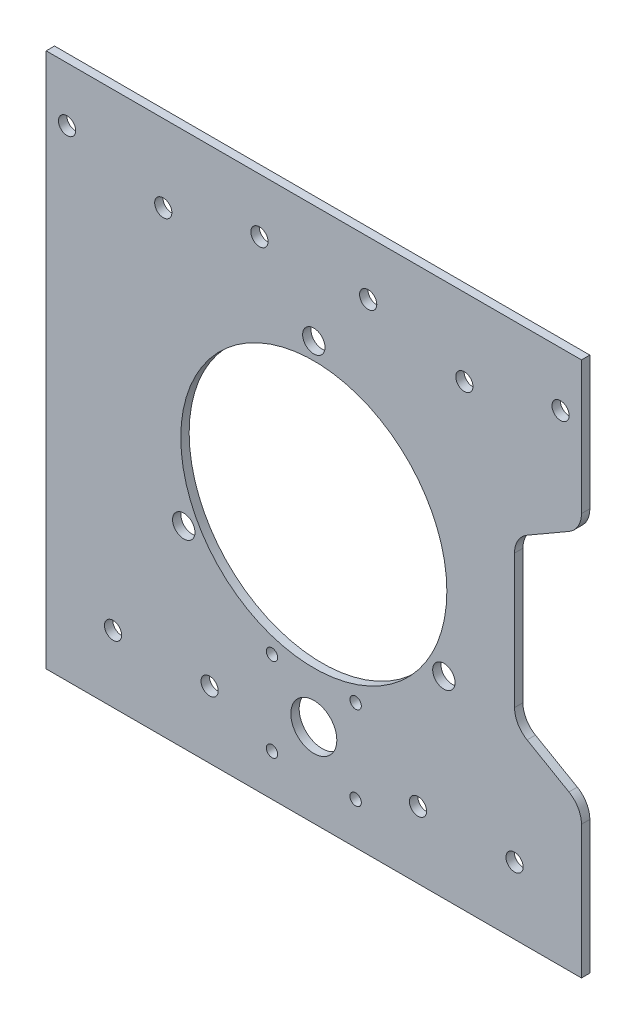
from build123d import *

# Parameters (mm, degrees)
SKETCH1_W               = 203.2
SKETCH1_H               = 203.2
BOSS_EXTRUDE1_DEPTH     = 3.175
SKETCH8_R               = 50.5
SKETCH8_R_2             = 4.25
CUT_EXTRUDE3_DEPTH      = 144.719172782
CUT_EXTRUDE4_DEPTH      = 144.719172782
F_1_4_CLEARANCE_HOLE2_D = 6.5278
F_1_4_CLEARANCE_HOLE1_D = 6.5278
F_8_CLEARANCE_HOLE2_D   = 4.3053
SKETCH19_R              = 8.73125
CUT_EXTRUDE5_DEPTH      = 144.719172782


with BuildPart() as part:
    # Sketch1 → Boss-Extrude1 (new body)
    with BuildSketch(Plane.XY):
        Rectangle(SKETCH1_W, SKETCH1_H)
    extrude(amount=-BOSS_EXTRUDE1_DEPTH)

    # Sketch8 → Cut-Extrude3 (cut, through all)
    with BuildSketch(Plane.XY):
        Circle(SKETCH8_R)
        with Locations((0, 57)):
            Circle(SKETCH8_R_2)
        with Locations((-49.363448016, -28.5)):
            Circle(SKETCH8_R_2)
        with Locations((49.363448016, -28.5)):
            Circle(SKETCH8_R_2)
    extrude(amount=-CUT_EXTRUDE3_DEPTH, mode=Mode.SUBTRACT)

    # Sketch10 → Cut-Extrude4 (cut, through all)
    with BuildSketch(Plane.XY):
        with BuildLine():
            Line((96.8375, 42.814327494), (80.9625, 33.648891971))
            ThreePointArc((80.9625, 33.648891971), (77.476108029, 30.1625), (76.2, 25.4))
            Line((76.2, 25.4), (76.2, -25.4))
            ThreePointArc((76.2, -25.4), (77.476108029, -30.1625), (80.9625, -33.648891971))
            Line((80.9625, -33.648891971), (96.8375, -42.814327494))
            ThreePointArc((96.8375, -42.814327494), (100.323891971, -46.300719465), (101.6, -51.063219465))
            Line((101.6, -51.063219465), (101.6, 51.063219465))
            ThreePointArc((101.6, 51.063219465), (100.323891971, 46.300719465), (96.8375, 42.814327494))
        make_face()
    extrude(amount=-CUT_EXTRUDE4_DEPTH, mode=Mode.SUBTRACT)

    # 1/4 Clearance Hole2 (through all)
    with Locations(Plane.XY):
        with Locations((76.2, -76.2), (39.553111932, -76.2), (-39.553111932, -76.2), (-76.2, -76.2)):
            Hole(F_1_4_CLEARANCE_HOLE2_D / 2)

    # 1/4 Clearance Hole1 (through all)
    with Locations(Plane.XY):
        with Locations((-93.6625, 80.9625), (-57.15, 72.23125), (-20.6375, 80.9625), (20.6375, 80.9625), (57.15, 72.23125), (93.6625, 80.9625)):
            Hole(F_1_4_CLEARANCE_HOLE1_D / 2)

    # #8 Clearance Hole2 (through all)
    with Locations(Plane.XY):
        with Locations((-15.874990337, -53.95749371), (15.874990337, -53.95749371), (-15.874990337, -85.74250629), (15.874990337, -85.74250629)):
            Hole(F_8_CLEARANCE_HOLE2_D / 2)

    # Sketch19 → Cut-Extrude5 (cut, through all)
    with BuildSketch(Plane.XY):
        with Locations((0, -69.85)):
            Circle(SKETCH19_R)
    extrude(amount=-CUT_EXTRUDE5_DEPTH, mode=Mode.SUBTRACT)


solid = part.part
